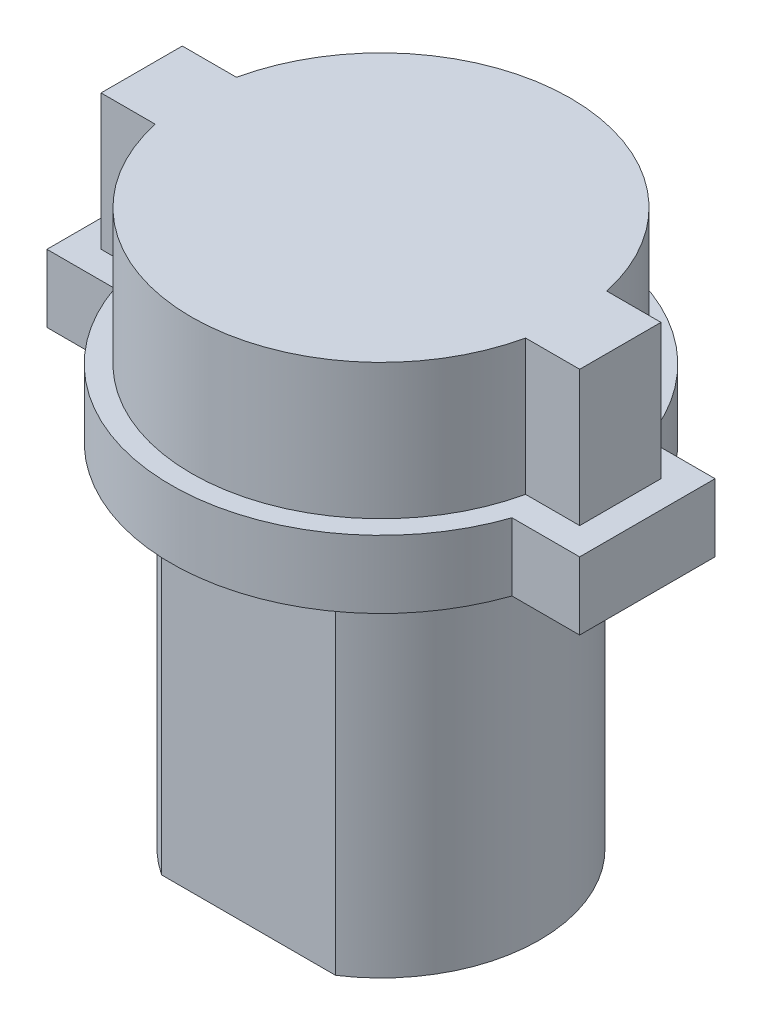
from build123d import *

# Parameters (mm, degrees)
BOSS_EXTRUDE1_DEPTH = 13
BOSS_EXTRUDE2_DEPTH = 2.5
SKETCH3_R           = 7
BOSS_EXTRUDE3_DEPTH = 5


with BuildPart() as part:
    # Sketch1 → Boss-Extrude1 (new body)
    with BuildSketch(Plane(origin=(0, 0, 0), x_dir=(1, 0, 0), z_dir=(0, 1, 0))):
        with BuildLine():
            ThreePointArc((5.85, 0), (5.148142373, 2.778332254), (3.210981158, 4.89))
            Line((3.210981158, 4.89), (-3.210981158, 4.89))
            ThreePointArc((-3.210981158, 4.89), (-5.148142373, 2.778332254), (-5.85, 0))
            Line((-5.85, 0), (5.85, 0))
        make_face()
        with BuildLine():
            ThreePointArc((3.210981158, -4.89), (5.148142373, -2.778332254), (5.85, 0))
            Line((5.85, 0), (-5.85, 0))
            ThreePointArc((-5.85, 0), (-5.148142373, -2.778332254), (-3.210981158, -4.89))
            Line((-3.210981158, -4.89), (3.210981158, -4.89))
        make_face()
    extrude(amount=BOSS_EXTRUDE1_DEPTH)

    # Sketch2 → Boss-Extrude2 (add)
    with BuildSketch(Plane(origin=(0, 13, 0), x_dir=(1, 0, 0), z_dir=(0, 1, 0))):
        with BuildLine():
            Line((0, 4.89), (0, 7.75))
            ThreePointArc((0, 7.75), (-4.510404638, 6.302281333), (-7.335700376, 2.5))
            ThreePointArc((-7.335700376, 2.5), (-7.75, 0), (-7.335700376, -2.5))
            ThreePointArc((-7.335700376, -2.5), (-4.510404638, -6.302281333), (0, -7.75))
            Line((0, -7.75), (0, -4.89))
            Line((0, -4.89), (-3.210981158, -4.89))
            ThreePointArc((-3.210981158, -4.89), (-5.85, 0), (-3.210981158, 4.89))
            Line((-3.210981158, 4.89), (0, 4.89))
        make_face()
        with BuildLine():
            ThreePointArc((7.335700376, 2.5), (4.510404638, 6.302281333), (0, 7.75))
            Line((0, 7.75), (0, 4.89))
            Line((0, 4.89), (3.210981158, 4.89))
            ThreePointArc((3.210981158, 4.89), (5.85, 0), (3.210981158, -4.89))
            Line((3.210981158, -4.89), (0, -4.89))
            Line((0, -4.89), (0, -7.75))
            ThreePointArc((0, -7.75), (4.510404638, -6.302281333), (7.335700376, -2.5))
            ThreePointArc((7.335700376, -2.5), (7.645723573, -1.267048162), (7.75, 0))
            ThreePointArc((7.75, 0), (7.645723573, 1.267048162), (7.335700376, 2.5))
        make_face()
        with BuildLine():
            Line((3.210981158, 4.89), (0, 4.89))
            Line((0, 4.89), (0, -4.89))
            Line((0, -4.89), (3.210981158, -4.89))
            ThreePointArc((3.210981158, -4.89), (5.85, 0), (3.210981158, 4.89))
        make_face()
        with BuildLine():
            Line((9.835700376, 2.5), (7.335700376, 2.5))
            ThreePointArc((7.335700376, 2.5), (7.645723573, 1.267048162), (7.75, 0))
            ThreePointArc((7.75, 0), (7.645723573, -1.267048162), (7.335700376, -2.5))
            Line((7.335700376, -2.5), (9.835700376, -2.5))
            Line((9.835700376, -2.5), (9.835700376, 2.5))
        make_face()
        with BuildLine():
            Line((0, -4.89), (0, 4.89))
            Line((0, 4.89), (-3.210981158, 4.89))
            ThreePointArc((-3.210981158, 4.89), (-5.85, 0), (-3.210981158, -4.89))
            Line((-3.210981158, -4.89), (0, -4.89))
        make_face()
        with BuildLine():
            ThreePointArc((-7.335700376, -2.5), (-7.75, 0), (-7.335700376, 2.5))
            Line((-7.335700376, 2.5), (-9.835700376, 2.5))
            Line((-9.835700376, 2.5), (-9.835700376, -2.5))
            Line((-9.835700376, -2.5), (-7.335700376, -2.5))
        make_face()
    extrude(amount=BOSS_EXTRUDE2_DEPTH)

    # Sketch3 → Boss-Extrude3 (add)
    with BuildSketch(Plane(origin=(0, 15.5, 0), x_dir=(1, 0, 0), z_dir=(0, 1, 0))):
        Circle(SKETCH3_R)
        with BuildLine():
            ThreePointArc((-6.837397166, -1.5), (-7, 0), (-6.837397166, 1.5))
            Line((-6.837397166, 1.5), (-8.837397166, 1.5))
            Line((-8.837397166, 1.5), (-8.837397166, -1.5))
            Line((-8.837397166, -1.5), (-6.837397166, -1.5))
        make_face()
        with BuildLine():
            Line((8.837397166, 1.5), (6.837397166, 1.5))
            ThreePointArc((6.837397166, 1.5), (6.959230567, 0.754393744), (7, 0))
            ThreePointArc((7, 0), (6.959230567, -0.754393744), (6.837397166, -1.5))
            Line((6.837397166, -1.5), (8.837397166, -1.5))
            Line((8.837397166, -1.5), (8.837397166, 1.5))
        make_face()
    extrude(amount=BOSS_EXTRUDE3_DEPTH)


solid = part.part
